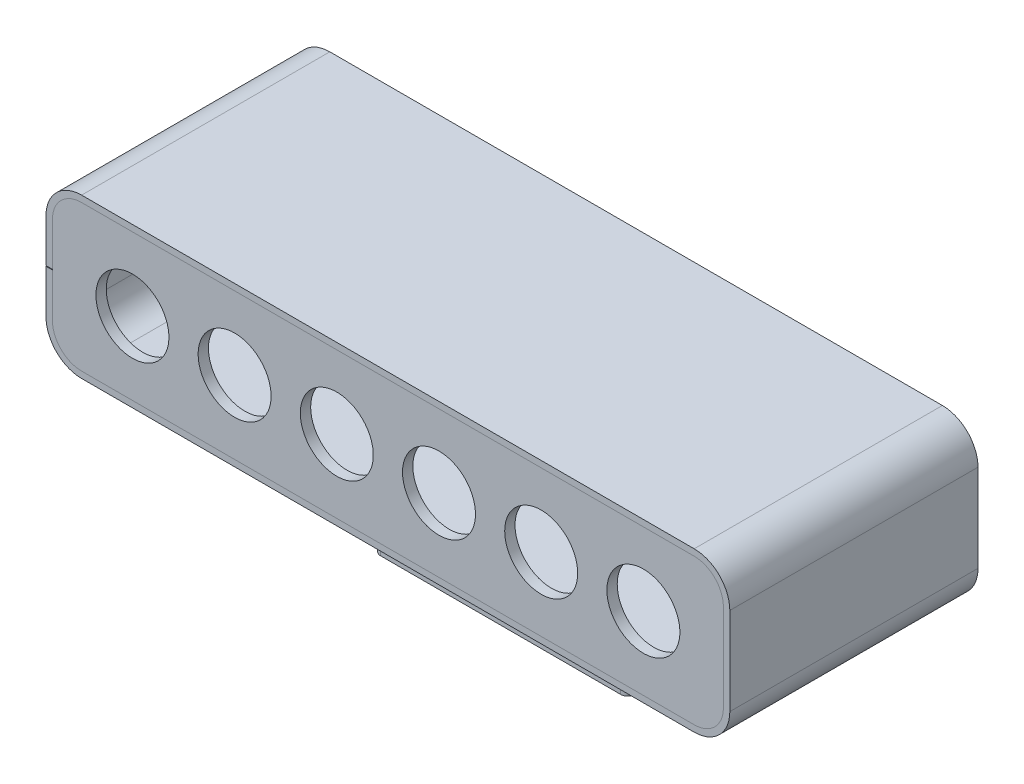
from build123d import *

# Parameters (mm, degrees)
SKETCH1_W           = 291.846
SKETCH1_H           = 63.5
BOSS_EXTRUDE1_DEPTH = 4.4958
FILLET1_R           = 12.7
BOSS_EXTRUDE2_DEPTH = 107.95
BOSS_EXTRUDE3_DEPTH = 4.4958
SKETCH2_R           = 15.875
CUT_EXTRUDE1_DEPTH  = 187.984589004
BOSS_EXTRUDE5_DEPTH = 50.8
SKETCH7_R           = 3.175
CUT_EXTRUDE2_DEPTH  = 4.4958
CUT_EXTRUDE3_DEPTH  = 2.794
CUT_EXTRUDE4_START  = -66.294
SKETCH9_R           = 15.875
CUT_EXTRUDE4_DEPTH  = 263.617967801
SKETCH10_R          = 1.74625
CUT_EXTRUDE5_DEPTH  = 2.794


with BuildPart() as part:
    # Sketch1 → Boss-Extrude1 (new body)
    with BuildSketch(Plane.XY):
        Rectangle(SKETCH1_W, SKETCH1_H)
    extrude(amount=BOSS_EXTRUDE1_DEPTH)

    # Fillet1
    fillet1_edges = [part.edges().sort_by_distance(p)[0] for p in [
        (145.923, -31.75, 2.2479),
        (-145.923, -31.75, 2.2479),
        (-145.923, 31.75, 2.2479),
        (145.923, 31.75, 2.2479),
    ]]
    fillet(fillet1_edges, radius=FILLET1_R)

    # Sketch7 → Cut-Extrude2 (cut)
    with BuildSketch(Plane(origin=(0, 0, 0), x_dir=(-1, 0, 0), z_dir=(0, 0, -1))):
        with Locations((-52.3875, 0)):
            Circle(SKETCH7_R)
        with Locations((52.3875, 0)):
            Circle(SKETCH7_R)
    extrude(amount=-CUT_EXTRUDE2_DEPTH, mode=Mode.SUBTRACT)


with BuildPart() as body_2:
    # Sketch3 → Boss-Extrude2 (new body)
    with BuildSketch(Plane.XY):
        with BuildLine():
            Line((133.223, 34.544), (-133.223, 34.544))
            ThreePointArc((-133.223, 34.544), (-144.178912468, 30.005912468), (-148.717, 19.05))
            Line((-148.717, 19.05), (-148.717, 0.254))
            Line((-148.717, 0.254), (-145.923, 0.254))
            Line((-145.923, 0.254), (-145.923, 19.05))
            ThreePointArc((-145.923, 19.05), (-142.203256121, 28.030256121), (-133.223, 31.75))
            Line((-133.223, 31.75), (133.223, 31.75))
            ThreePointArc((133.223, 31.75), (142.203256121, 28.030256121), (145.923, 19.05))
            Line((145.923, 19.05), (145.923, -19.05))
            ThreePointArc((145.923, -19.05), (142.203256121, -28.030256121), (133.223, -31.75))
            Line((133.223, -31.75), (-133.223, -31.75))
            ThreePointArc((-133.223, -31.75), (-142.203256121, -28.030256121), (-145.923, -19.05))
            Line((-145.923, -19.05), (-145.923, 0))
            Line((-145.923, 0), (-148.717, 0))
            Line((-148.717, 0), (-148.717, -19.05))
            ThreePointArc((-148.717, -19.05), (-144.178912468, -30.005912468), (-133.223, -34.544))
            Line((-133.223, -34.544), (133.223, -34.544))
            ThreePointArc((133.223, -34.544), (144.178912468, -30.005912468), (148.717, -19.05))
            Line((148.717, -19.05), (148.717, 19.05))
            ThreePointArc((148.717, 19.05), (144.178912468, 30.005912468), (133.223, 34.544))
        make_face()
    extrude(amount=BOSS_EXTRUDE2_DEPTH)

    # Sketch8 → Cut-Extrude3 (cut)
    with BuildSketch(Plane.XZ.offset(34.544)):
        with BuildLine():
            Line((-46.355, 53.594), (46.355, 53.594))
            ThreePointArc((46.355, 53.594), (49.049076836, 52.478076836), (50.165, 49.784))
            Line((50.165, 49.784), (50.165, 12.954))
            ThreePointArc((50.165, 12.954), (49.049076836, 10.259923164), (46.355, 9.144))
            Line((46.355, 9.144), (-46.355, 9.144))
            ThreePointArc((-46.355, 9.144), (-49.049076836, 10.259923164), (-50.165, 12.954))
            Line((-50.165, 12.954), (-50.165, 49.784))
            ThreePointArc((-50.165, 49.784), (-49.049076836, 52.478076836), (-46.355, 53.594))
        make_face()
    extrude(amount=-CUT_EXTRUDE3_DEPTH, mode=Mode.SUBTRACT)

    # Sketch9 → Cut-Extrude4 (cut, through all)
    with BuildSketch(Plane.XZ.offset(34.544).offset(CUT_EXTRUDE4_START)):
        with Locations(Location((-120.717, 25, 0), (0, 0, 141.978486401))):
            Circle(SKETCH9_R)
    extrude(amount=CUT_EXTRUDE4_DEPTH, mode=Mode.SUBTRACT)

    # Sketch10 → Cut-Extrude5 (cut)
    with BuildSketch(Plane.XZ.offset(34.544)):
        with Locations((63.5, 50.8)):
            Circle(SKETCH10_R)
        with Locations((63.5, 12.7)):
            Circle(SKETCH10_R)
        with Locations((-63.5, 50.8)):
            Circle(SKETCH10_R)
        with Locations((-63.5, 12.7)):
            Circle(SKETCH10_R)
    extrude(amount=-CUT_EXTRUDE5_DEPTH, mode=Mode.SUBTRACT)


with BuildPart() as body_3:
    # Sketch4 → Boss-Extrude3 (new body)
    with BuildSketch(Plane.XY.offset(107.95)):
        with BuildLine():
            Line((-145.923, 19.05), (-145.923, -19.05))
            ThreePointArc((-145.923, -19.05), (-142.203256121, -28.030256121), (-133.223, -31.75))
            Line((-133.223, -31.75), (133.223, -31.75))
            ThreePointArc((133.223, -31.75), (142.203256121, -28.030256121), (145.923, -19.05))
            Line((145.923, -19.05), (145.923, 19.05))
            ThreePointArc((145.923, 19.05), (142.203256121, 28.030256121), (133.223, 31.75))
            Line((133.223, 31.75), (-133.223, 31.75))
            ThreePointArc((-133.223, 31.75), (-142.203256121, 28.030256121), (-145.923, 19.05))
        make_face()
    extrude(amount=-BOSS_EXTRUDE3_DEPTH)

    # Sketch2 → Cut-Extrude1 (cut, through all)
    with BuildSketch(Plane(origin=(0, 0, 0), x_dir=(-1, 0, 0), z_dir=(0, 0, -1))):
        with Locations((-111.125, 0)):
            Circle(SKETCH2_R)
        with Locations((-66.675, 0)):
            Circle(SKETCH2_R)
        with Locations((-22.225, 0)):
            Circle(SKETCH2_R)
        with Locations((22.225, 0)):
            Circle(SKETCH2_R)
        with Locations((66.675, 0)):
            Circle(SKETCH2_R)
        with Locations((111.125, 0)):
            Circle(SKETCH2_R)
    extrude(amount=-CUT_EXTRUDE1_DEPTH, mode=Mode.SUBTRACT)


with BuildPart() as body_4:
    # Sketch6 → Boss-Extrude5 (new body)
    with BuildSketch(Plane.XZ.offset(34.544)):
        with BuildLine():
            Line((-52.245, 58.928), (52.245, 58.928))
            ThreePointArc((52.245, 58.928), (54.366320344, 58.049320344), (55.245, 55.928))
            Line((55.245, 55.928), (55.245, 6.81))
            ThreePointArc((55.245, 6.81), (54.366320344, 4.688679656), (52.245, 3.81))
            Line((52.245, 3.81), (-52.245, 3.81))
            ThreePointArc((-52.245, 3.81), (-54.366320344, 4.688679656), (-55.245, 6.81))
            Line((-55.245, 6.81), (-55.245, 55.928))
            ThreePointArc((-55.245, 55.928), (-54.366320344, 58.049320344), (-52.245, 58.928))
        make_face()
        with BuildLine():
            Line((-52.705, 55.928), (-52.705, 6.81))
            ThreePointArc((-52.705, 6.81), (-52.570269119, 6.484730881), (-52.245, 6.35))
            Line((-52.245, 6.35), (52.245, 6.35))
            ThreePointArc((52.245, 6.35), (52.570269119, 6.484730881), (52.705, 6.81))
            Line((52.705, 6.81), (52.705, 55.928))
            ThreePointArc((52.705, 55.928), (52.570269119, 56.253269119), (52.245, 56.388))
            Line((52.245, 56.388), (-52.245, 56.388))
            ThreePointArc((-52.245, 56.388), (-52.570269119, 56.253269119), (-52.705, 55.928))
        make_face(mode=Mode.SUBTRACT)
    extrude(amount=BOSS_EXTRUDE5_DEPTH)


solid = Compound([part.part, body_2.part, body_3.part, body_4.part])
